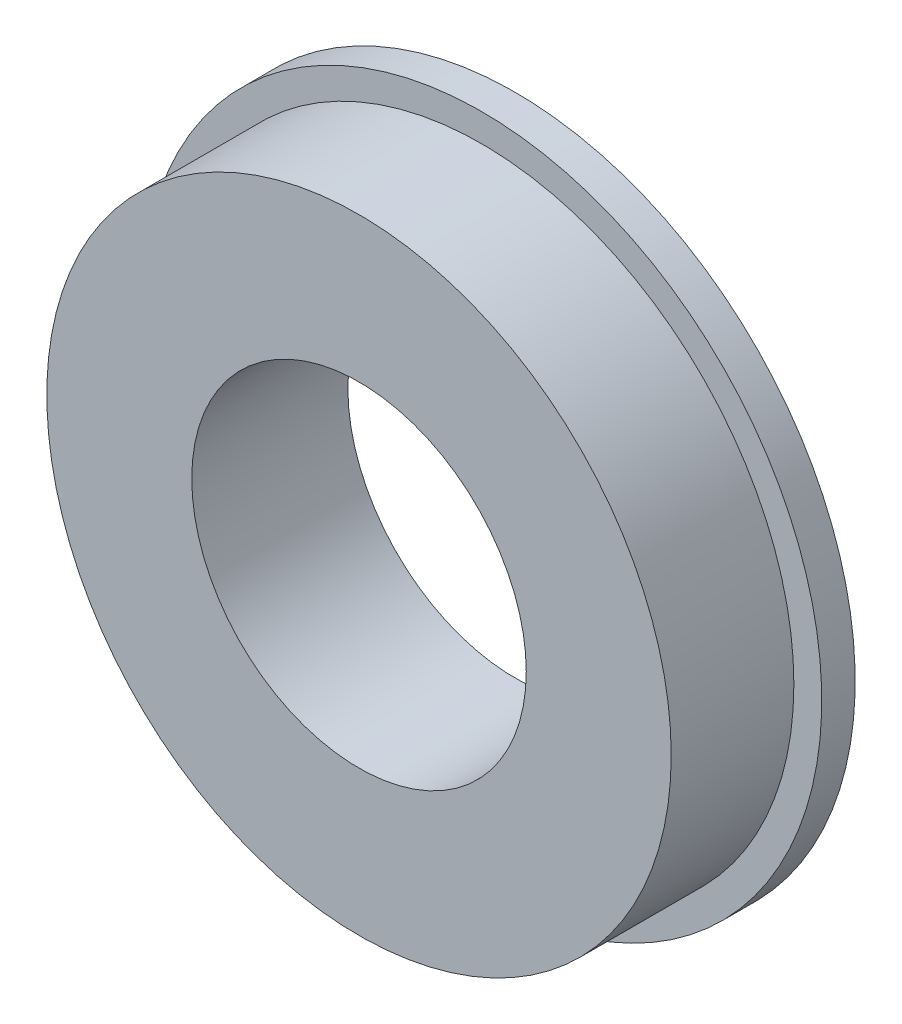
from build123d import *
from build123d.topology import SkipClean

# Parameters (mm, degrees)
SKETCH_1_R      = 14
SKETCH_1_R_2    = 7.5
EXTRUDE_1_DEPTH = 5.5
EXTRUDE_START   = 1.5
SKETCH_2_R      = 15.25
SKETCH_2_R_2    = 7.5
EXTRUDE_3_DEPTH = 1.5


with BuildPart() as part:
    # 草图1 → 凸台-拉伸1 (new body)
    with BuildSketch(Plane.XY):
        Circle(SKETCH_1_R)
        Circle(SKETCH_1_R_2, mode=Mode.SUBTRACT)
    extrude(amount=EXTRUDE_1_DEPTH)

    # 草图2 → 凸台-拉伸3 (add)
    with SkipClean():  # the faces are left unmerged after this step: merging them gives an invalid solid
        with BuildSketch(Plane(origin=(0, 0, 0), x_dir=(-1, 0, 0), z_dir=(0, 0, -1)).offset(EXTRUDE_START)):
            Circle(SKETCH_2_R)
            Circle(SKETCH_2_R_2, mode=Mode.SUBTRACT)
        extrude(amount=-EXTRUDE_3_DEPTH)


solid = part.part
